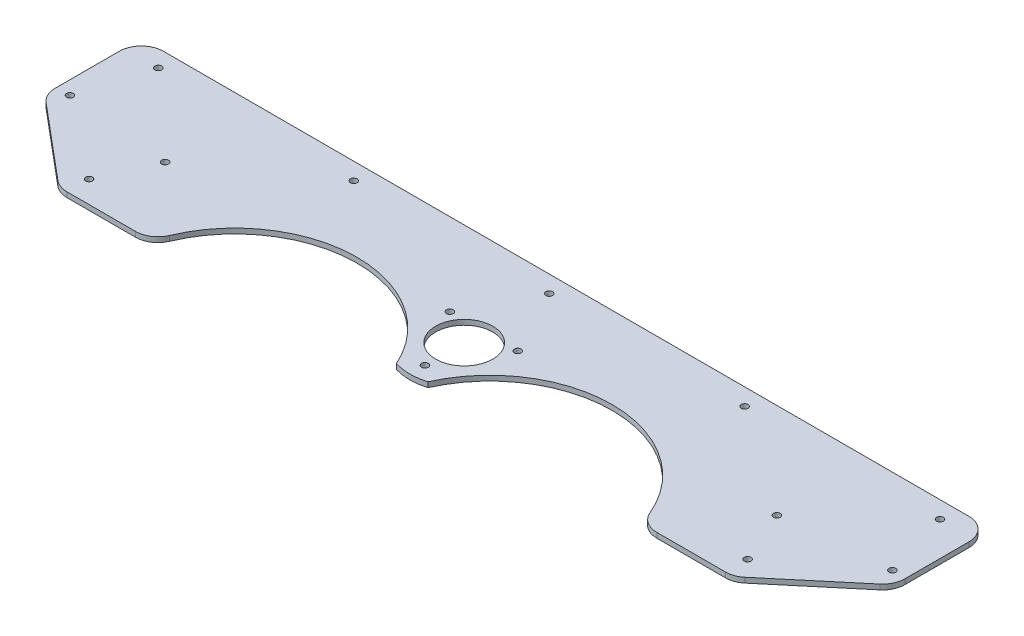
from build123d import *

# Parameters (mm, degrees)
BOSS_EXTRU_1_DEPTH      = 1.5
ESQUISSE2_R             = 1
ENL_V_MAT_EXTRU_1_DEPTH = 135.637476209
ESQUISSE4_R             = 36
ENL_V_MAT_EXTRU_3_DEPTH = 135.637476209
CONG_1_R                = 6.5
ESQUISSE3_R             = 8.4
ESQUISSE3_R_2           = 1
ENL_V_MAT_EXTRU_2_DEPTH = 1.5
ENL_V_MAT_EXTRU_4_DEPTH = 135.637476209


with BuildPart() as part:
    # Esquisse1 → Boss.-Extru.1 (new body)
    with BuildSketch(Plane(origin=(0, 0, 0), x_dir=(1, 0, 0), z_dir=(0, 1, 0))):
        Polygon((99.25, -50), (125, -28.393184497), (125, 0), (0, 0), (0, -50), align=None)
    extrude(amount=BOSS_EXTRU_1_DEPTH)

    # Esquisse2 → Enlèv. mat.-Extru.1 (cut, through all)
    with BuildSketch(Plane(origin=(0, 1.5, 0), x_dir=(1, 0, 0), z_dir=(0, 1, 0))):
        with Locations((0, -5)):
            Circle(ESQUISSE2_R)
        with Locations(Location((57.5, -5, 0), (0, 0, 270))):
            Circle(ESQUISSE2_R)
        with Locations(Location((115, -5, 0), (0, 0, 270))):
            Circle(ESQUISSE2_R)
        with Locations(Location((96.884193477, -43.5, 0), (0, 0, 270))):
            Circle(ESQUISSE2_R)
        with Locations(Location((90, -28, 0), (0, 0, 270))):
            Circle(ESQUISSE2_R)
        with Locations(Location((121, -25, 0), (0, 0, 270))):
            Circle(ESQUISSE2_R)
    extrude(amount=-ENL_V_MAT_EXTRU_1_DEPTH, mode=Mode.SUBTRACT)

    # Esquisse4 → Enlèv. mat.-Extru.3 (cut, through all)
    with BuildSketch(Plane(origin=(0, 1.5, 0), x_dir=(1, 0, 0), z_dir=(0, 1, 0))):
        with Locations((37.5, -60)):
            Circle(ESQUISSE4_R)
    extrude(amount=-ENL_V_MAT_EXTRU_3_DEPTH, mode=Mode.SUBTRACT)

    # Congé1
    cong_1_edges = [part.edges().sort_by_distance(p)[0] for p in [
        (125, 0.75, 28.393184497),
        (99.25, 0.75, 50),
        (125, 0.75, 0),
        (72.083232932, 0.75, 50),
    ]]
    fillet(cong_1_edges, radius=CONG_1_R)

    # Symétrie1: part across plane


with BuildPart() as part_1:
    add(part.part)
    add(part.part.mirror(Plane(origin=(0, 0, 0), x_dir=(0, 0, 1), z_dir=(1, 0, 0))))

    # Esquisse3 → Enlèv. mat.-Extru.2 (cut)
    with BuildSketch(Plane(origin=(0, 1.5, 0), x_dir=(1, 0, 0), z_dir=(0, 1, 0))):
        with Locations(Location((0, -30, 0), (0, 0, 270))):
            Circle(ESQUISSE3_R)
        with Locations(Location((0, -41.547005384, 0), (0, 0, 270))):
            Circle(ESQUISSE3_R_2)
        with Locations(Location((-10, -24.226497308, 0), (0, 0, 270))):
            Circle(ESQUISSE3_R_2)
        with Locations(Location((10, -24.226497308, 0), (0, 0, 270))):
            Circle(ESQUISSE3_R_2)
    extrude(amount=-ENL_V_MAT_EXTRU_2_DEPTH, mode=Mode.SUBTRACT)

    # Esquisse5 → Enlèv. mat.-Extru.4 (cut, through all)
    with BuildSketch(Plane(origin=(0, 1.5, 0), x_dir=(1, 0, 0), z_dir=(0, 1, 0))):
        with BuildLine():
            Line((7.702133216, -44.02416286), (7.702133216, -51.975452854))
            Line((7.702133216, -51.975452854), (-8.276969641, -51.975452854))
            Line((-8.276969641, -51.975452854), (-6.500509259, -44.619965095))
            ThreePointArc((-6.500509259, -44.619965095), (0.670611742, -45.985940069), (7.702133216, -44.02416286))
        make_face()
    extrude(amount=-ENL_V_MAT_EXTRU_4_DEPTH, mode=Mode.SUBTRACT)


solid = part_1.part
